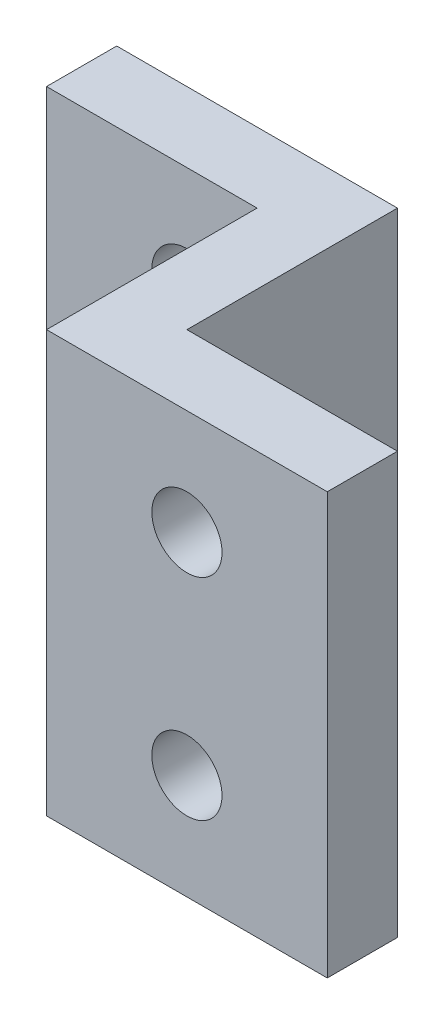
from build123d import *

# Parameters (mm, degrees)
IZIM1_W                          = 15
IZIM1_H                          = 30
IZIM1_R                          = 2.5
Y_KSEKLIK_EKSTR_ZYON1_DEPTH      = 5
Y_KSEKLIK_EKSTR_ZYON2_DEPTH      = 15
Y_KSEKLIK_EKSTR_ZYON2_DEPTH_BACK = 5
IZIM2_W                          = 5
IZIM2_H                          = 30
IZIM3_W                          = 15
IZIM3_H                          = 30
Y_KSEKLIK_EKSTR_ZYON3_DEPTH      = 5
IZIM4_R                          = 2.5
KES_EKSTR_ZYON1_DEPTH            = 10


with BuildPart() as part:
    # Çizim1 → Yükseklik-Ekstrüzyon1 (new body)
    with BuildSketch(Plane.XY):
        with Locations((-28.692769378, 6.725163294)):
            Rectangle(IZIM1_W, IZIM1_H)
        with Locations((-31.192769378, 14.225163294)):
            Circle(IZIM1_R, mode=Mode.SUBTRACT)
        with Locations((-31.192769378, -0.774836706)):
            Circle(IZIM1_R, mode=Mode.SUBTRACT)
    extrude(amount=Y_KSEKLIK_EKSTR_ZYON1_DEPTH)

    # Çizim2 → Yükseklik-Ekstrüzyon2 (add, two sides: drawn at the far end of the back side and taken through both)
    with BuildSketch(Plane(origin=(0, 0, 0), x_dir=(-1, 0, 0), z_dir=(0, 0, -1)).offset(-Y_KSEKLIK_EKSTR_ZYON2_DEPTH_BACK)):
        with Locations((38.692769378, 6.725163294)):
            Rectangle(IZIM2_W, IZIM2_H)
    extrude(amount=Y_KSEKLIK_EKSTR_ZYON2_DEPTH + Y_KSEKLIK_EKSTR_ZYON2_DEPTH_BACK)

    # Çizim3 → Yükseklik-Ekstrüzyon3 (add)
    with BuildSketch(Plane(origin=(0, 0, -15), x_dir=(-1, 0, 0), z_dir=(0, 0, -1))):
        with Locations((48.692769378, 6.725163294)):
            Rectangle(IZIM3_W, IZIM3_H)
    extrude(amount=-Y_KSEKLIK_EKSTR_ZYON3_DEPTH)

    # Çizim4 → Kes-Ekstrüzyon1 (cut)
    with BuildSketch(Plane.XY.offset(-10)):
        with Locations((-46.192769378, 14.225163294)):
            Circle(IZIM4_R)
        with Locations((-46.192769378, -0.774836706)):
            Circle(IZIM4_R)
    extrude(amount=-KES_EKSTR_ZYON1_DEPTH, mode=Mode.SUBTRACT)


solid = part.part
